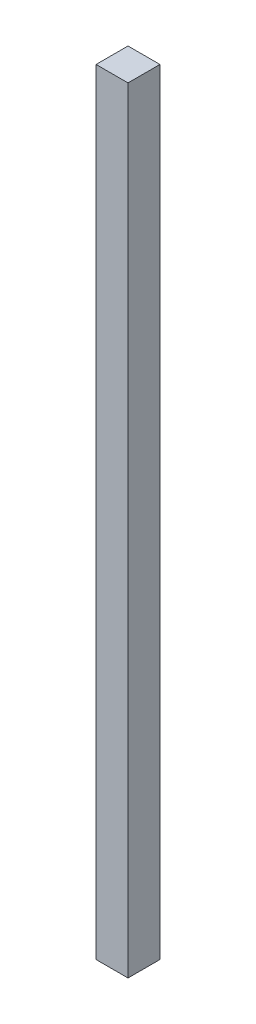
from build123d import *

# Parameters (mm, degrees)
SKETCH_1_W      = 30
SKETCH_1_H      = 30
EXTRUDE_1_DEPTH = 728


with BuildPart() as part:
    # 草图1 → 凸台-拉伸1 (new body)
    with BuildSketch(Plane(origin=(0, 0, 0), x_dir=(1, 0, 0), z_dir=(0, 1, 0))):
        Rectangle(SKETCH_1_W, SKETCH_1_H)
    extrude(amount=EXTRUDE_1_DEPTH)


solid = part.part
